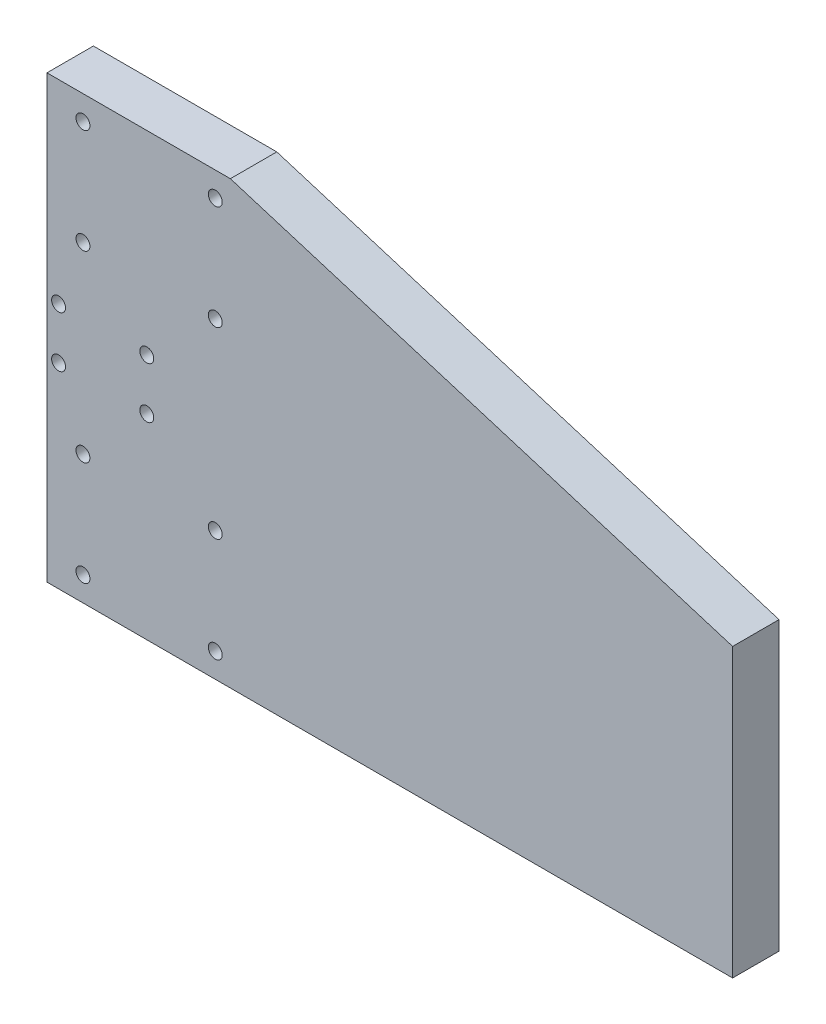
from build123d import *

# Parameters (mm, degrees)
BOSS_EXTRUDE1_DEPTH      = 20
SCHIZZO6_R               = 3
TAGLIO_ESTRUSIONE1_DEPTH = 282.870567709


with BuildPart() as part:
    # Sketch1 → Boss-Extrude1 (new body)
    with BuildSketch(Plane.XY):
        Polygon((35, -64), (-43.999999997, -64), (-43.999999997, 126), (35, 126), (251.346408251, 59.694869443), (251.346408251, -64), align=None)
    extrude(amount=BOSS_EXTRUDE1_DEPTH)

    # Schizzo6 → Taglio-Estrusione1 (cut, through all)
    with BuildSketch(Plane.XY.offset(20)):
        with Locations((28.5, -53.5)):
            Circle(SCHIZZO6_R)
        with Locations((-28.5, -53.5)):
            Circle(SCHIZZO6_R)
        with Locations((-28.5, -8.5)):
            Circle(SCHIZZO6_R)
        with Locations((28.5, -8.5)):
            Circle(SCHIZZO6_R)
        with Locations((28.5, 115.5)):
            Circle(SCHIZZO6_R)
        with Locations((28.5, 70.5)):
            Circle(SCHIZZO6_R)
        with Locations((-28.5, 115.5)):
            Circle(SCHIZZO6_R)
        with Locations((-28.5, 70.5)):
            Circle(SCHIZZO6_R)
        with Locations((-38.999999997, 20.3)):
            Circle(SCHIZZO6_R)
        with Locations((-38.999999997, 42.3)):
            Circle(SCHIZZO6_R)
        with Locations((-0.999999997, 20.3)):
            Circle(SCHIZZO6_R)
        with Locations((-0.999999997, 42.3)):
            Circle(SCHIZZO6_R)
    extrude(amount=-TAGLIO_ESTRUSIONE1_DEPTH, mode=Mode.SUBTRACT)


solid = part.part
